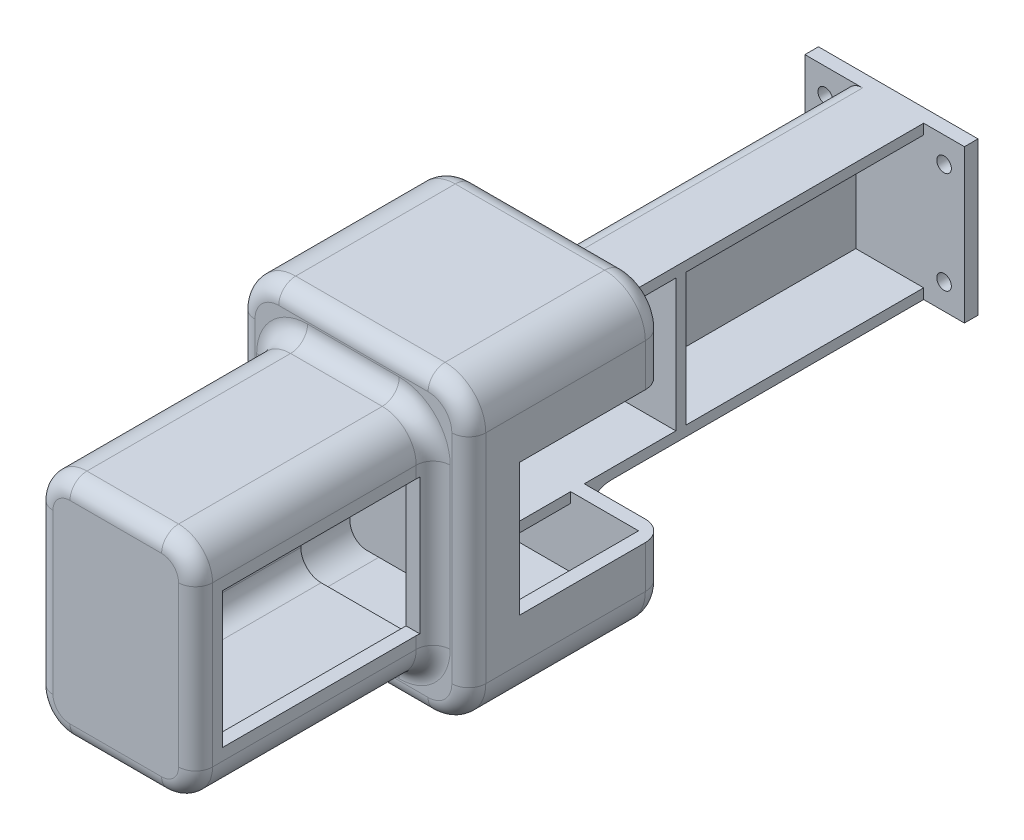
from build123d import *

# Parameters (mm, degrees)
EXTRUDE_1_DEPTH     = 150
FILLET_1_R          = 5
SKETCH_2_W          = 47
SKETCH_2_H          = 45
SKETCH_2_R          = 2.15
EXTRUDE_2_DEPTH     = 4
EXTRUDE_START       = 74
SKETCH_3_W          = 20.5
SKETCH_3_H          = 40
EXTRUDE_3_DEPTH     = 3
EXTRUDE_START_2     = 147
SKETCH_4_W          = 20.5
SKETCH_4_H          = 40
EXTRUDE_4_DEPTH     = 3
EXTRUDE_START_3     = 104
EXTRUDE_5_DEPTH     = 4
EXTRUDE_START_4     = 108
EXTRUDE_6_DEPTH     = 50
EXTRUDE_START_5     = 158
EXTRUDE_7_DEPTH     = 4
EXTRUDE_START_6     = 162
EXTRUDE_8_DEPTH     = 66
EXTRUDE_START_7     = 228
EXTRUDE_9_DEPTH     = 4
FILLET_2_R          = 8
FILLET_3_R          = 6
FILLET_4_R          = 5
FILLET_5_R          = 5
FILLET_6_R          = 5
CUT_EXTRUDE_START   = 77
SKETCH_10_W         = 49
SKETCH_10_H         = 39
CUT_EXTRUDE_1_DEPTH = 70
CUT_EXTRUDE_START_2 = 157
CUT_EXTRUDE_2_DEPTH = 8
CUT_EXTRUDE_START_3 = 166
SKETCH_12_W         = 11
SKETCH_12_H         = 40
CUT_EXTRUDE_3_DEPTH = 58


with BuildPart() as part:
    # 草圖1 → 填料-伸長1 (new body)
    with BuildSketch(Plane.XY):
        Polygon((-13, -22.5), (10, -22.5), (10, -19.5), (-10, -19.5), (-10, 19.5), (10, 19.5), (10, 22.5), (-13, 22.5), align=None)
    extrude(amount=EXTRUDE_1_DEPTH)

    # 圓角1
    fillet_1_edges = [part.edges().sort_by_distance(p)[0] for p in [
        (-13, 22.5, 75),
        (-13, -22.5, 75),
    ]]
    fillet(fillet_1_edges, radius=FILLET_1_R)

    # 草圖2 → 填料-伸長2 (add)
    with BuildSketch(Plane.XY):
        with Locations((-1.5, 0)):
            Rectangle(SKETCH_2_W, SKETCH_2_H)
        with Locations((-19, 15)):
            Circle(SKETCH_2_R, mode=Mode.SUBTRACT)
        with Locations((-19, -15)):
            Circle(SKETCH_2_R, mode=Mode.SUBTRACT)
        with Locations((16, 15)):
            Circle(SKETCH_2_R, mode=Mode.SUBTRACT)
        with Locations((16, -15)):
            Circle(SKETCH_2_R, mode=Mode.SUBTRACT)
    extrude(amount=EXTRUDE_2_DEPTH)

    # 草圖3 → 填料-伸長3 (add)
    with BuildSketch(Plane.XY.offset(EXTRUDE_START)):
        with Locations((-0.25, 0)):
            Rectangle(SKETCH_3_W, SKETCH_3_H)
    extrude(amount=EXTRUDE_3_DEPTH)

    # 草圖4 → 填料-伸長4 (add)
    with BuildSketch(Plane.XY.offset(EXTRUDE_START_2)):
        with Locations((-0.25, 0)):
            Rectangle(SKETCH_4_W, SKETCH_4_H)
    extrude(amount=EXTRUDE_4_DEPTH)

    # 草圖5 → 填料-伸長5 (add)
    with BuildSketch(Plane.XY.offset(EXTRUDE_START_3)):
        with BuildLine():
            Line((34, -32), (34, 32))
            ThreePointArc((34, 32), (30.485281374, 40.485281374), (22, 44))
            Line((22, 44), (-22, 44))
            ThreePointArc((-22, 44), (-30.485281374, 40.485281374), (-34, 32))
            Line((-34, 32), (-34, -32))
            ThreePointArc((-34, -32), (-30.485281374, -40.485281374), (-22, -44))
            Line((-22, -44), (22, -44))
            ThreePointArc((22, -44), (30.485281374, -40.485281374), (34, -32))
        make_face()
    extrude(amount=EXTRUDE_5_DEPTH)

    # 草圖6 → 填料-伸長6 (add)
    with BuildSketch(Plane.XY.offset(EXTRUDE_START_4)):
        with BuildLine():
            Line((34, -32), (34, 32))
            ThreePointArc((34, 32), (30.485281374, 40.485281374), (22, 44))
            Line((22, 44), (-22, 44))
            ThreePointArc((-22, 44), (-30.485281374, 40.485281374), (-34, 32))
            Line((-34, 32), (-34, -32))
            ThreePointArc((-34, -32), (-30.485281374, -40.485281374), (-22, -44))
            Line((-22, -44), (22, -44))
            ThreePointArc((22, -44), (30.485281374, -40.485281374), (34, -32))
        make_face()
        with BuildLine():
            Line((30, -32), (30, 32))
            ThreePointArc((30, 32), (27.656854249, 37.656854249), (22, 40))
            Line((22, 40), (-22, 40))
            ThreePointArc((-22, 40), (-27.656854249, 37.656854249), (-30, 32))
            Line((-30, 32), (-30, -32))
            ThreePointArc((-30, -32), (-27.656854249, -37.656854249), (-22, -40))
            Line((-22, -40), (22, -40))
            ThreePointArc((22, -40), (27.656854249, -37.656854249), (30, -32))
        make_face(mode=Mode.SUBTRACT)
    extrude(amount=EXTRUDE_6_DEPTH)

    # 草圖7 → 填料-伸長7 (add)
    with BuildSketch(Plane.XY.offset(EXTRUDE_START_5)):
        with BuildLine():
            Line((34, -32), (34, 32))
            ThreePointArc((34, 32), (30.485281374, 40.485281374), (22, 44))
            Line((22, 44), (-22, 44))
            ThreePointArc((-22, 44), (-30.485281374, 40.485281374), (-34, 32))
            Line((-34, 32), (-34, -32))
            ThreePointArc((-34, -32), (-30.485281374, -40.485281374), (-22, -44))
            Line((-22, -44), (22, -44))
            ThreePointArc((22, -44), (30.485281374, -40.485281374), (34, -32))
        make_face()
    extrude(amount=EXTRUDE_7_DEPTH)

    # 草圖8 → 填料-伸長8 (add)
    with BuildSketch(Plane.XY.offset(EXTRUDE_START_6)):
        with BuildLine():
            Line((23.5, -23.5), (23.5, 23.5))
            ThreePointArc((23.5, 23.5), (20.571067812, 30.571067812), (13.5, 33.5))
            Line((13.5, 33.5), (-13.5, 33.5))
            ThreePointArc((-13.5, 33.5), (-20.571067812, 30.571067812), (-23.5, 23.5))
            Line((-23.5, 23.5), (-23.5, -23.5))
            ThreePointArc((-23.5, -23.5), (-20.571067812, -30.571067812), (-13.5, -33.5))
            Line((-13.5, -33.5), (13.5, -33.5))
            ThreePointArc((13.5, -33.5), (20.571067812, -30.571067812), (23.5, -23.5))
        make_face()
        with BuildLine():
            Line((19.5, -23.5), (19.5, 23.5))
            ThreePointArc((19.5, 23.5), (17.742640687, 27.742640687), (13.5, 29.5))
            Line((13.5, 29.5), (-13.5, 29.5))
            ThreePointArc((-13.5, 29.5), (-17.742640687, 27.742640687), (-19.5, 23.5))
            Line((-19.5, 23.5), (-19.5, -23.5))
            ThreePointArc((-19.5, -23.5), (-17.742640687, -27.742640687), (-13.5, -29.5))
            Line((-13.5, -29.5), (13.5, -29.5))
            ThreePointArc((13.5, -29.5), (17.742640687, -27.742640687), (19.5, -23.5))
        make_face(mode=Mode.SUBTRACT)
    extrude(amount=EXTRUDE_8_DEPTH)

    # 草圖9 → 填料-伸長9 (add)
    with BuildSketch(Plane.XY.offset(EXTRUDE_START_7)):
        with BuildLine():
            Line((23.5, -23.5), (23.5, 23.5))
            ThreePointArc((23.5, 23.5), (20.571067812, 30.571067812), (13.5, 33.5))
            Line((13.5, 33.5), (-13.5, 33.5))
            ThreePointArc((-13.5, 33.5), (-20.571067812, 30.571067812), (-23.5, 23.5))
            Line((-23.5, 23.5), (-23.5, -23.5))
            ThreePointArc((-23.5, -23.5), (-20.571067812, -30.571067812), (-13.5, -33.5))
            Line((-13.5, -33.5), (13.5, -33.5))
            ThreePointArc((13.5, -33.5), (20.571067812, -30.571067812), (23.5, -23.5))
        make_face()
    extrude(amount=EXTRUDE_9_DEPTH)

    # 圓角2
    fillet_2_edges = [part.edges().sort_by_distance(p)[0] for p in [
        (-11.535533906, -21.035533906, 104),
        (1, 22.5, 104),
        (-13, 0, 104),
        (1, -22.5, 104),
        (-11.535533906, 21.035533906, 104),
    ]]
    fillet(fillet_2_edges, radius=FILLET_2_R)

    # 圓角3
    fillet_3_edges = [part.edges().sort_by_distance(p)[0] for p in [
        (30.485281374, -40.485281374, 104),
        (34, 0, 104),
        (30.485281374, 40.485281374, 104),
        (0, 44, 104),
        (-30.485281374, 40.485281374, 104),
        (-34, 0, 104),
        (-30.485281374, -40.485281374, 104),
        (0, -44, 104),
    ]]
    fillet(fillet_3_edges, radius=FILLET_3_R)

    # 圓角4
    fillet_4_edges = [part.edges().sort_by_distance(p)[0] for p in [
        (30.485281374, -40.485281374, 162),
        (34, 0, 162),
        (30.485281374, 40.485281374, 162),
        (0, 44, 162),
        (-30.485281374, 40.485281374, 162),
        (-34, 0, 162),
        (-30.485281374, -40.485281374, 162),
        (0, -44, 162),
    ]]
    fillet(fillet_4_edges, radius=FILLET_4_R)

    # 圓角5
    fillet_5_edges = [part.edges().sort_by_distance(p)[0] for p in [
        (20.571067812, -30.571067812, 162),
        (23.5, 0, 162),
        (20.571067812, 30.571067812, 162),
        (0, 33.5, 162),
        (-20.571067812, 30.571067812, 162),
        (-23.5, 0, 162),
        (-20.571067812, -30.571067812, 162),
        (0, -33.5, 162),
    ]]
    fillet(fillet_5_edges, radius=FILLET_5_R)

    # 圓角6
    fillet_6_edges = [part.edges().sort_by_distance(p)[0] for p in [
        (20.571067812, -30.571067812, 232),
        (23.5, 0, 232),
        (20.571067812, 30.571067812, 232),
        (0, 33.5, 232),
        (-20.571067812, 30.571067812, 232),
        (-23.5, 0, 232),
        (-20.571067812, -30.571067812, 232),
        (0, -33.5, 232),
    ]]
    fillet(fillet_6_edges, radius=FILLET_6_R)

    # 草圖10 → 除料-伸長1 (cut)
    with BuildSketch(Plane.XY.offset(CUT_EXTRUDE_START)):
        with Locations((14.5, 0)):
            Rectangle(SKETCH_10_W, SKETCH_10_H)
    extrude(amount=CUT_EXTRUDE_1_DEPTH, mode=Mode.SUBTRACT)

    # 草圖11 → 除料-伸長2 (cut)
    with BuildSketch(Plane.XY.offset(CUT_EXTRUDE_START_2)):
        with BuildLine():
            Line((19.5, -23.5), (19.5, 23.5))
            ThreePointArc((19.5, 23.5), (17.742640687, 27.742640687), (13.5, 29.5))
            Line((13.5, 29.5), (-13.5, 29.5))
            ThreePointArc((-13.5, 29.5), (-17.742640687, 27.742640687), (-19.5, 23.5))
            Line((-19.5, 23.5), (-19.5, -23.5))
            ThreePointArc((-19.5, -23.5), (-17.742640687, -27.742640687), (-13.5, -29.5))
            Line((-13.5, -29.5), (13.5, -29.5))
            ThreePointArc((13.5, -29.5), (17.742640687, -27.742640687), (19.5, -23.5))
        make_face()
    extrude(amount=CUT_EXTRUDE_2_DEPTH, mode=Mode.SUBTRACT)

    # 草圖12 → 除料-伸長3 (cut)
    with BuildSketch(Plane.XY.offset(CUT_EXTRUDE_START_3)):
        with Locations((23, 0)):
            Rectangle(SKETCH_12_W, SKETCH_12_H)
    extrude(amount=CUT_EXTRUDE_3_DEPTH, mode=Mode.SUBTRACT)


solid = part.part
